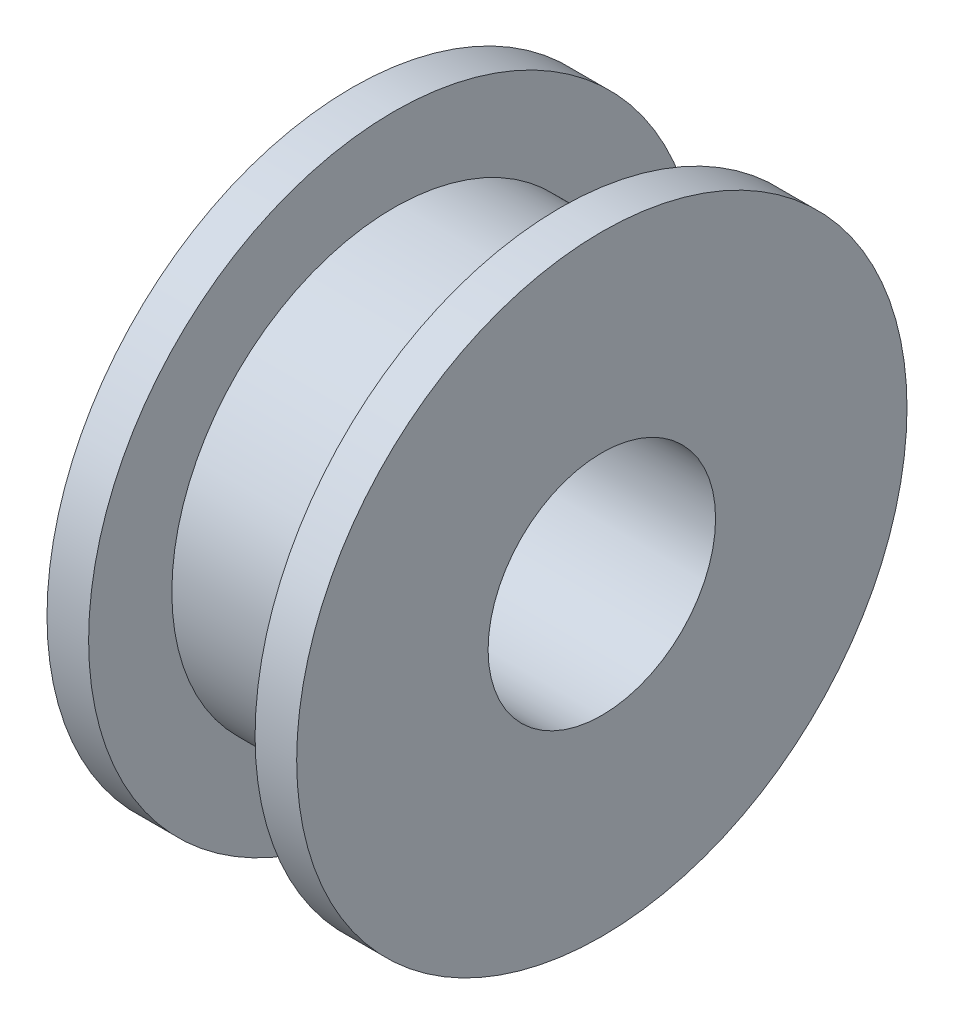
from build123d import *

# Parameters (mm, degrees)
SKETCH1_W = 9
SKETCH1_H = 6.9
SKETCH2_W = 6
SKETCH2_H = 3


with BuildPart() as part:
    # Sketch1 → Revolve1 (revolve)
    with BuildSketch(Plane.XY, mode=Mode.PRIVATE) as revolve1_sk:
        with Locations((-1, 7.55)):
            Rectangle(SKETCH1_W, SKETCH1_H)
    revolve(revolve1_sk.sketch.rotate(Axis((0, 0, 0), (1, 0, 0)), 90), axis=Axis((0, 0, 0), (1, 0, 0)))

    # Sketch2 → Cut-Revolve1 (revolve, cut)
    with BuildSketch(Plane.XY, mode=Mode.PRIVATE) as cut_revolve1_sk:
        with Locations((-1, 9.5)):
            Rectangle(SKETCH2_W, SKETCH2_H)
    revolve(cut_revolve1_sk.sketch.rotate(Axis((0, 0, 0), (1, 0, 0)), 90), axis=Axis((0, 0, 0), (1, 0, 0)), mode=Mode.SUBTRACT)


solid = part.part
